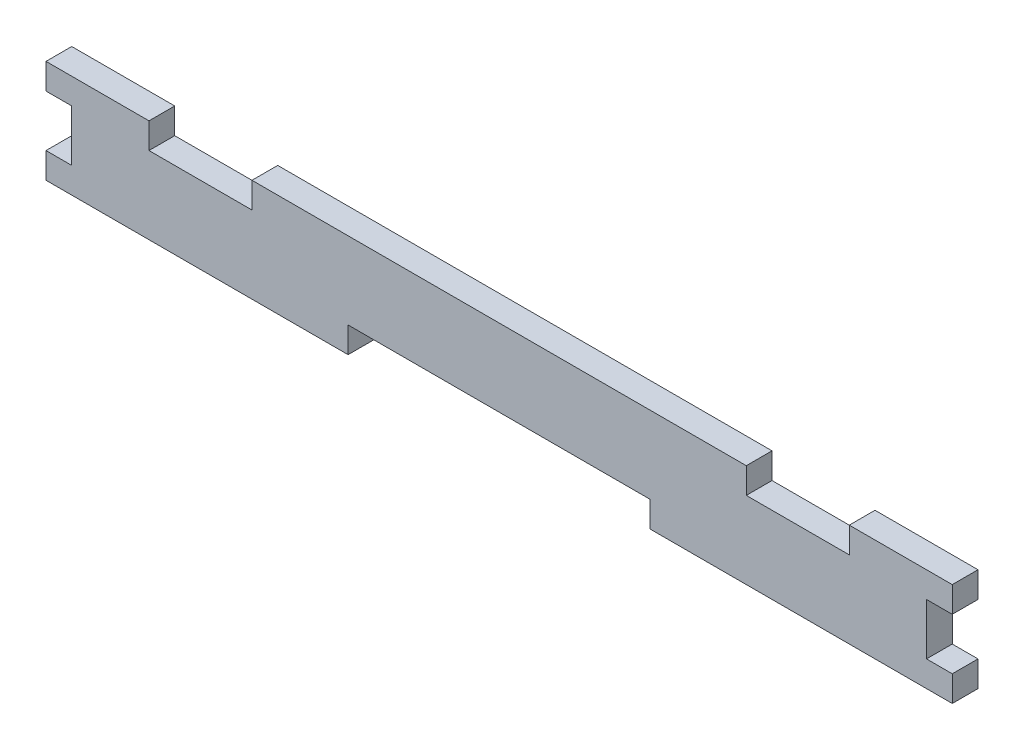
from build123d import *

# Parameters (mm, degrees)
SALIENTE_EXTRUIR1_DEPTH = 5


with BuildPart() as part:
    # Croquis1 → Saliente-Extruir1 (new body)
    with BuildSketch(Plane.XY):
        Polygon((117.333333333, 0), (176, 0), (176, 5), (171, 5), (171, 15), (176, 15), (176, 20), (156, 20), (156, 15), (136, 15), (136, 20), (40, 20), (40, 15), (20, 15), (20, 20), (0, 20), (0, 15), (5, 15), (5, 5), (0, 5), (0, 0), (58.666666667, 0), (58.666666667, 5), (117.333333333, 5), align=None)
    extrude(amount=SALIENTE_EXTRUIR1_DEPTH)


solid = part.part
